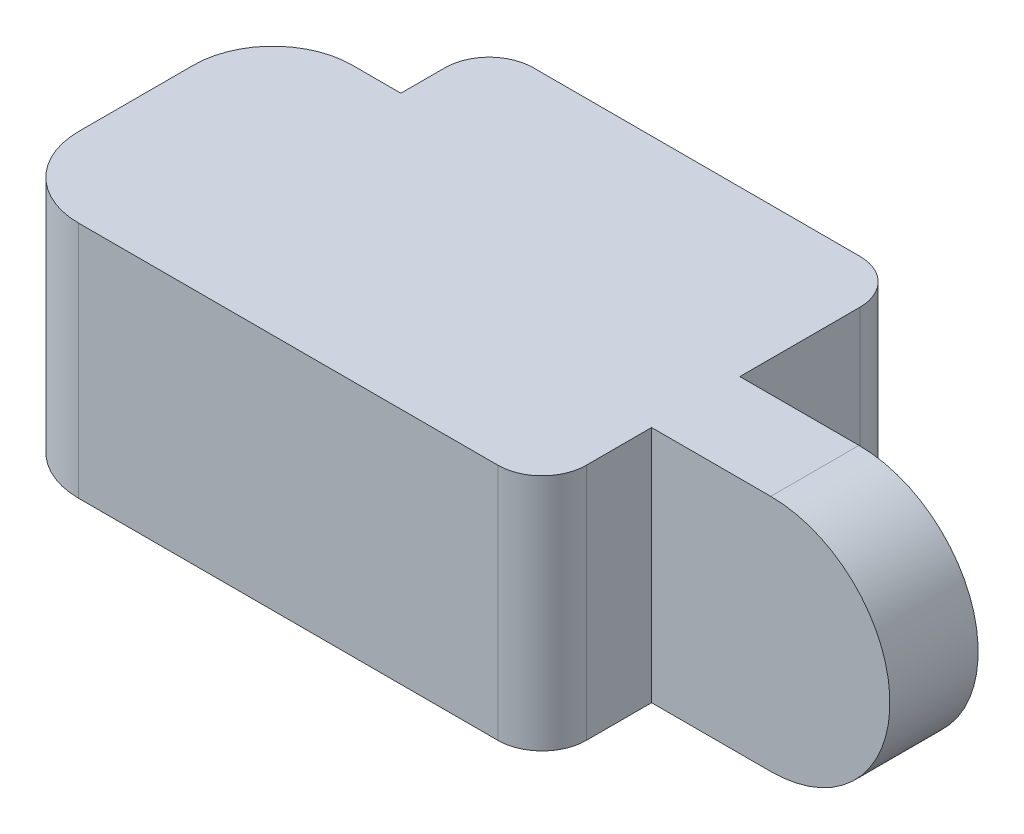
from build123d import *

# Parameters (mm, degrees)
BOSS_EXTRUDE1_DEPTH      = 34.29
BOSS_EXTRUDE1_DEPTH_BACK = 34.29
CUT_EXTRUDE1_DEPTH       = 203.631037198
CUT_EXTRUDE1_DEPTH_BACK  = 203.631037198


with BuildPart() as part:
    # Sketch1 → Boss-Extrude1 (new, two sides: drawn at the far end of the back side and taken through both)
    with BuildSketch(Plane(origin=(0, 0, 0), x_dir=(1, 0, 0), z_dir=(0, 1, 0)).offset(-BOSS_EXTRUDE1_DEPTH_BACK)):
        with BuildLine():
            Line((-34.29, -12.7), (34.29, -12.7))
            Line((34.29, -12.7), (34.29, 12.7))
            Line((34.29, 12.7), (-34.29, 12.7))
            Line((-34.29, 12.7), (-34.29, 47.244))
            ThreePointArc((-34.29, 47.244), (-38.009743879, 56.224256121), (-46.99, 59.944))
            Line((-46.99, 59.944), (-140.97, 59.944))
            ThreePointArc((-140.97, 59.944), (-149.950256121, 56.224256121), (-153.67, 47.244))
            Line((-153.67, 47.244), (-153.67, 34.544))
            Line((-153.67, 34.544), (-167.64, 34.544))
            ThreePointArc((-167.64, 34.544), (-183.804461018, 27.848461018), (-190.5, 11.684))
            Line((-190.5, 11.684), (-190.5, -21.336))
            ThreePointArc((-190.5, -21.336), (-183.804461018, -37.500461018), (-167.64, -44.196))
            Line((-167.64, -44.196), (-46.99, -44.196))
            ThreePointArc((-46.99, -44.196), (-38.009743879, -40.476256121), (-34.29, -31.496))
            Line((-34.29, -31.496), (-34.29, -12.7))
        make_face()
    extrude(amount=BOSS_EXTRUDE1_DEPTH + BOSS_EXTRUDE1_DEPTH_BACK)

    # Sketch2 → Cut-Extrude1 (cut, two sides: drawn at the far end of the back side and taken through both)
    with BuildSketch(Plane.XY.offset(-CUT_EXTRUDE1_DEPTH_BACK)):
        with BuildLine():
            Line((0, 34.29), (44.29, 34.29))
            Line((44.29, 34.29), (44.29, -34.29))
            Line((44.29, -34.29), (0, -34.29))
            ThreePointArc((0, -34.29), (34.29, 0), (0, 34.29))
        make_face()
    extrude(amount=CUT_EXTRUDE1_DEPTH + CUT_EXTRUDE1_DEPTH_BACK, mode=Mode.SUBTRACT)


solid = part.part
